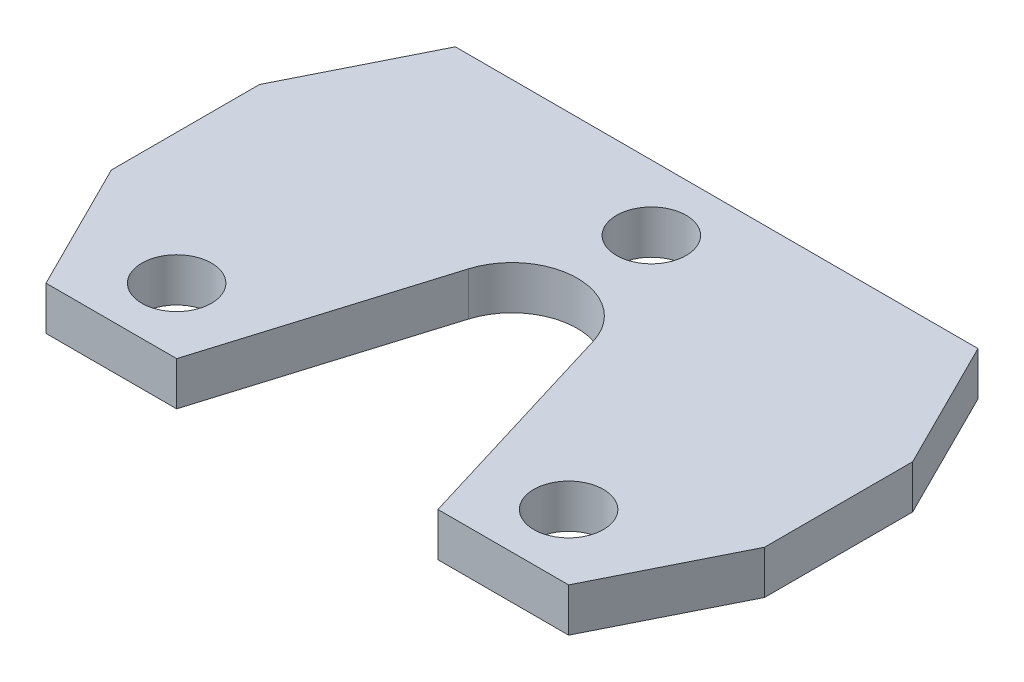
from build123d import *

# Parameters (mm, degrees)
SKETCH1_R           = 8
BOSS_EXTRUDE1_DEPTH = 10


with BuildPart() as part:
    # Sketch1 → Boss-Extrude1 (new body)
    with BuildSketch(Plane(origin=(0, 0, 0), x_dir=(1, 0, 0), z_dir=(0, 1, 0))):
        with BuildLine():
            Line((-60, 27.300970874), (60, 27.300970874))
            Line((60, 27.300970874), (75, -2.699029126))
            Line((75, -2.699029126), (75, -36.699029126))
            Line((75, -36.699029126), (60, -66.699029126))
            Line((60, -66.699029126), (30, -66.699029126))
            Line((30, -66.699029126), (14.348632755, -15.327388431))
            ThreePointArc((14.348632755, -15.327388431), (-0.000213283, -4.699051312), (-14.348995591, -15.327474469))
            Line((-14.348995591, -15.327474469), (-30, -66.699029126))
            Line((-30, -66.699029126), (-60, -66.699029126))
            Line((-60, -66.699029126), (-75, -36.699029126))
            Line((-75, -36.699029126), (-75, -2.699029126))
            Line((-75, -2.699029126), (-60, 27.300970874))
        make_face()
        with Locations(Location((-45, -51.699029126, 0), (0, 0, 270))):
            Circle(SKETCH1_R, mode=Mode.SUBTRACT)
        with Locations(Location((0, 12.300970874, 0), (0, 0, 270))):
            Circle(SKETCH1_R, mode=Mode.SUBTRACT)
        with Locations(Location((45, -51.699029126, 0), (0, 0, 270))):
            Circle(SKETCH1_R, mode=Mode.SUBTRACT)
    extrude(amount=BOSS_EXTRUDE1_DEPTH)


solid = part.part
